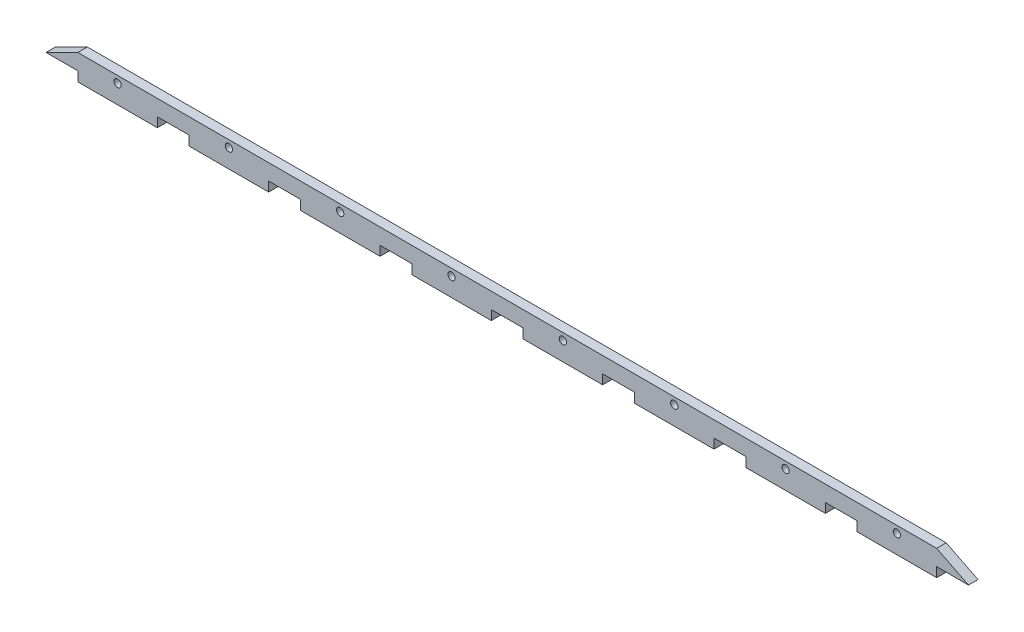
from build123d import *

# Parameters (mm, degrees)
EXTRUDE_1_DEPTH     = 3
SKETCH_2_R          = 1.15
CUT_EXTRUDE_1_DEPTH = 291.058614766


with BuildPart() as part:
    # 草图1 → 凸台-拉伸1 (new body)
    with BuildSketch(Plane.XY):
        Polygon((0, 0), (10, 5), (280, 5), (290, 0), (280, 0), (280, -3), (255, -3), (255, 0), (245, 0), (245, -3), (220, -3), (220, 0), (210, 0), (210, -3), (185, -3), (185, 0), (175, 0), (175, -3), (150, -3), (150, 0), (140, 0), (140, -3), (115, -3), (115, 0), (105, 0), (105, -3), (80, -3), (80, 0), (70, 0), (70, -3), (45, -3), (45, 0), (35, 0), (35, -3), (10, -3), (10, 0), align=None)
    extrude(amount=EXTRUDE_1_DEPTH)

    # 草图2 → 切除-拉伸1 (cut, through all)
    with BuildSketch(Plane.XY.offset(3)):
        with Locations((22.5, 2.85)):
            Circle(SKETCH_2_R)
        with Locations((57.5, 2.85)):
            Circle(SKETCH_2_R)
        with Locations((92.5, 2.85)):
            Circle(SKETCH_2_R)
        with Locations((127.5, 2.85)):
            Circle(SKETCH_2_R)
        with Locations((162.5, 2.85)):
            Circle(SKETCH_2_R)
        with Locations((197.5, 2.85)):
            Circle(SKETCH_2_R)
        with Locations((232.5, 2.85)):
            Circle(SKETCH_2_R)
        with Locations((267.5, 2.85)):
            Circle(SKETCH_2_R)
    extrude(amount=-CUT_EXTRUDE_1_DEPTH, mode=Mode.SUBTRACT)


solid = part.part
